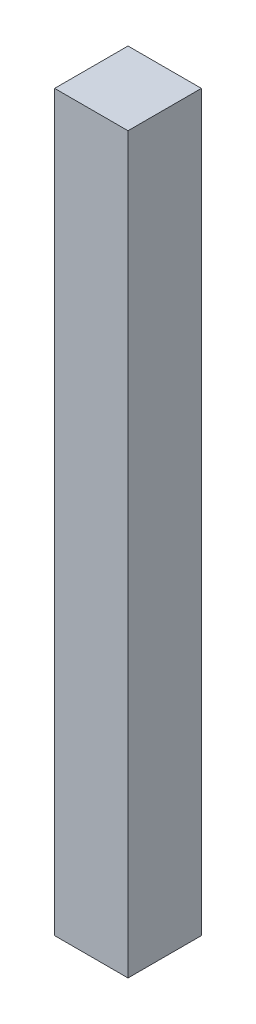
from build123d import *

# Parameters (mm, degrees)
SKETCH1_W           = 20
SKETCH1_H           = 20
BOSS_EXTRUDE1_DEPTH = 200


with BuildPart() as part:
    # Sketch1 → Boss-Extrude1 (new body)
    with BuildSketch(Plane(origin=(0, 0, 0), x_dir=(1, 0, 0), z_dir=(0, 1, 0))):
        with Locations((10, -10)):
            Rectangle(SKETCH1_W, SKETCH1_H)
    extrude(amount=BOSS_EXTRUDE1_DEPTH)


solid = part.part
